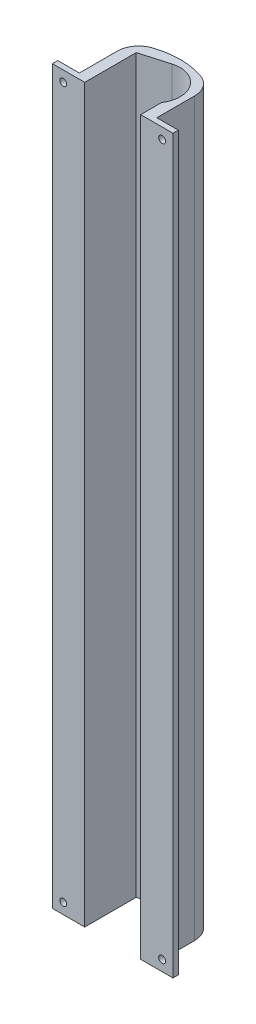
from build123d import *

# Parameters (mm, degrees)
BOSS_EXTRUDE1_DEPTH = 431.8
FILLET2_R           = 12.7
SKETCH2_R           = 2.032
CUT_EXTRUDE1_DEPTH  = 436.166892099
SCALE1_SCALE        = 0.25


with BuildPart() as part:
    # Sketch1 → Boss-Extrude1 (new body)
    with BuildSketch(Plane(origin=(0, 0, 0), x_dir=(1, 0, 0), z_dir=(0, 1, 0))):
        with BuildLine():
            Line((12.446, -95.666893232), (12.446, -83.267976842))
            ThreePointArc((12.446, -83.267976842), (12.103082443, -66.082532596), (-4.162019583, -60.523437125))
            Line((-4.162019583, -60.523437125), (-20.574, -65.268050741))
            Line((-20.574, -65.268050741), (-20.574, -84.572180345))
            Line((-20.574, -84.572180345), (-20.574, -95.666893232))
            Line((-20.574, -95.666893232), (-39.624, -95.666893232))
            Line((-39.624, -95.666893232), (-39.624, -92.491893232))
            Line((-39.624, -92.491893232), (-26.924, -92.491893232))
            Line((-26.924, -92.491893232), (-26.924, -62.093050741))
            ThreePointArc((-26.924, -62.093050741), (-4.064, -55.764211531), (18.796, -62.093050741))
            Line((18.796, -62.093050741), (18.796, -92.491893232))
            Line((18.796, -92.491893232), (31.496, -92.491893232))
            Line((31.496, -92.491893232), (31.496, -95.666893232))
            Line((31.496, -95.666893232), (12.446, -95.666893232))
        make_face()
    extrude(amount=BOSS_EXTRUDE1_DEPTH)

    # Fillet2
    fillet2_edges = [part.edges().sort_by_distance(p)[0] for p in [
        (-26.924, 215.9, 62.093050741),
        (18.796, 215.9, 62.093050741),
    ]]
    fillet(fillet2_edges, radius=FILLET2_R)

    # Sketch2 → Cut-Extrude1 (cut, through all)
    with BuildSketch(Plane(origin=(0, 0, 92.491893232), x_dir=(-1, 0, 0), z_dir=(0, 0, -1))):
        with Locations((-25.146, 425.45)):
            Circle(SKETCH2_R)
        with Locations((-25.146, 6.35)):
            Circle(SKETCH2_R)
        with Locations((33.274, 425.45)):
            Circle(SKETCH2_R)
        with Locations((33.274, 6.35)):
            Circle(SKETCH2_R)
    extrude(amount=-CUT_EXTRUDE1_DEPTH, mode=Mode.SUBTRACT)


with BuildPart() as part_1:
    # Scale1: scaled about (-5.110319003, 215.9, 75.736877767)
    add(part.part.scale(SCALE1_SCALE).moved(Location((-3.832739252, 161.925, 56.802658325))))


solid = part_1.part
